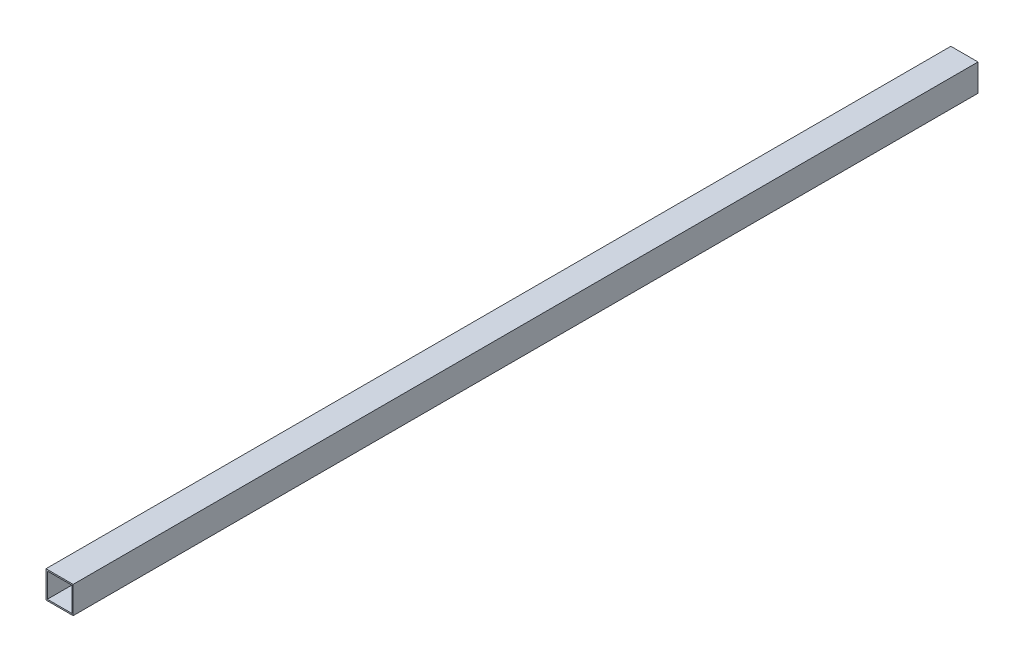
from build123d import *

# Parameters (mm, degrees)
SKETCH1_W           = 30
SKETCH1_H           = 30
SKETCH1_W_2         = 27
SKETCH1_H_2         = 27
BOSS_EXTRUDE1_DEPTH = 1000


with BuildPart() as part:
    # Sketch1 → Boss-Extrude1 (new body)
    with BuildSketch(Plane.XY):
        Rectangle(SKETCH1_W, SKETCH1_H)
        Rectangle(SKETCH1_W_2, SKETCH1_H_2, mode=Mode.SUBTRACT)
    extrude(amount=BOSS_EXTRUDE1_DEPTH)


solid = part.part
